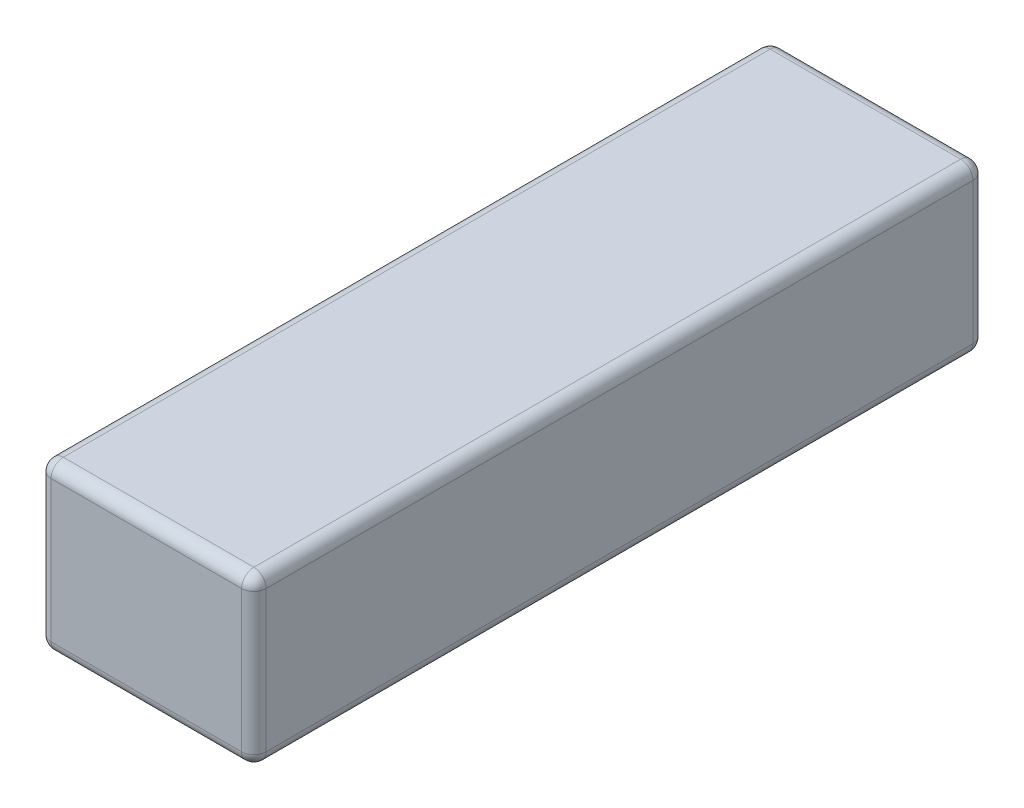
from build123d import *

# Parameters (mm, degrees)
SKETCH_1_W      = 35
SKETCH_1_H      = 27
EXTRUDE_1_DEPTH = 119
FILLET_2_R      = 2


with BuildPart() as part:
    # 草图1 → 凸台-拉伸1 (new body)
    with BuildSketch(Plane(origin=(-9.740659453, 0, 0), x_dir=(1, 0, 0), z_dir=(0, 0, 1))):
        with Locations((-86.97826087, 41.391260093)):
            Rectangle(SKETCH_1_W, SKETCH_1_H)
    extrude(amount=EXTRUDE_1_DEPTH)

    # 圆角2
    fillet_2_edges = [part.edges().sort_by_distance(p)[0] for p in [
        (-79.218920322, 41.391260093, 119),
        (-96.718920322, 54.891260093, 119),
        (-114.218920322, 41.391260093, 119),
        (-96.718920322, 54.891260093, 0),
        (-79.218920322, 41.391260093, 0),
        (-96.718920322, 27.891260093, 0),
        (-114.218920322, 41.391260093, 0),
        (-114.218920322, 54.891260093, 59.5),
        (-79.218920322, 54.891260093, 59.5),
        (-79.218920322, 27.891260093, 59.5),
        (-114.218920322, 27.891260093, 59.5),
        (-96.718920322, 27.891260093, 119),
    ]]
    fillet(fillet_2_edges, radius=FILLET_2_R)


solid = part.part
